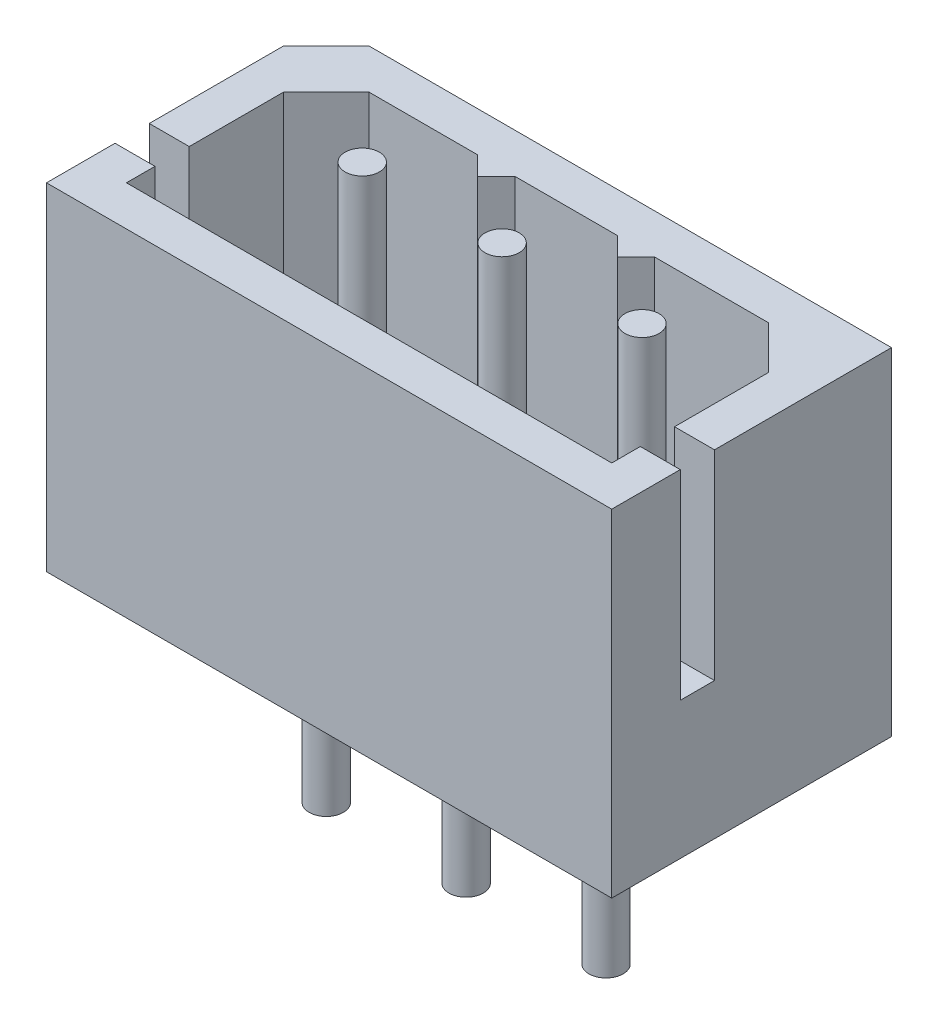
from build123d import *

# Parameters (mm, degrees)
BOSS_EXTRUDE1_DEPTH = 5.9
SKETCH2_R           = 0.3
BOSS_EXTRUDE2_DEPTH = 3.5
SKETCH3_R           = 0.3
CUT_EXTRUDE1_DEPTH  = 3.5


with BuildPart() as part:
    # Sketch1 → Boss-Extrude1 (new body)
    with BuildSketch(Plane(origin=(0, 0, 0), x_dir=(1, 0, 0), z_dir=(0, 1, 0))):
        Polygon((-4.2, 2.45), (-4.95, 1.7), (-4.95, -2.45), (4.95, -2.45), (4.95, 2.45), align=None)
    extrude(amount=-BOSS_EXTRUDE1_DEPTH)

    # Sketch2 → Boss-Extrude2 (add)
    with BuildSketch(Plane.XZ.offset(5.9)):
        with Locations((-2.5, 0)):
            Circle(SKETCH2_R)
        with Locations((-0.05, 0)):
            Circle(SKETCH2_R)
        with Locations((2.4, 0)):
            Circle(SKETCH2_R)
    extrude(amount=BOSS_EXTRUDE2_DEPTH)

    # Sketch3 → Cut-Extrude1 (cut)
    with BuildSketch(Plane(origin=(0, 0, 0), x_dir=(1, 0, 0), z_dir=(0, 1, 0))):
        Polygon((-1.603247496, 1.75), (-3.5, 1.75), (-4.25, 1), (-4.25, -0.65), (-4.95, -0.65), (-4.95, -1.25), (-4.25, -1.25), (-4.25, -1.75), (4.25, -1.75), (4.25, -1.25), (4.95, -1.25), (4.95, -0.65), (4.25, -0.65), (4.25, 1), (3.5, 1.75), (1.503247496, 1.75), (1.175, 1.421752504), (0.846752504, 1.75), (-0.946752504, 1.75), (-1.275, 1.421752504), align=None)
        with Locations((-2.5, 0.63)):
            Circle(SKETCH3_R, mode=Mode.SUBTRACT)
        with Locations((-0.05, 0.63)):
            Circle(SKETCH3_R, mode=Mode.SUBTRACT)
        with Locations((2.4, 0.63)):
            Circle(SKETCH3_R, mode=Mode.SUBTRACT)
    extrude(amount=-CUT_EXTRUDE1_DEPTH, mode=Mode.SUBTRACT)


solid = part.part
